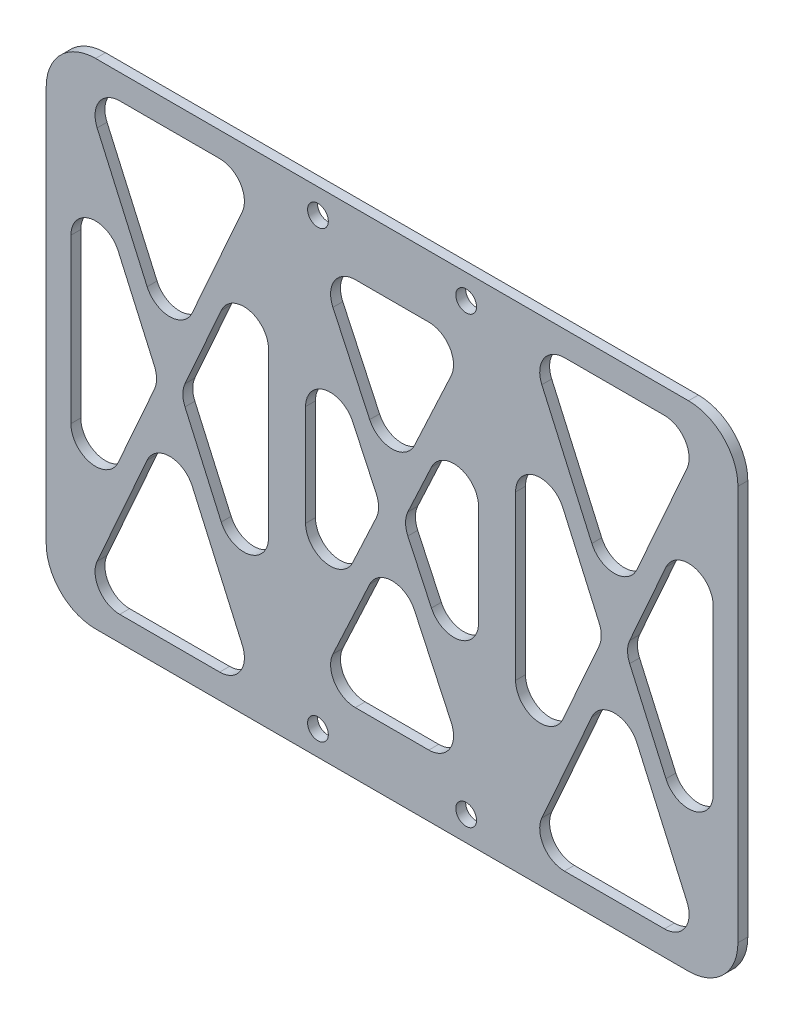
from build123d import *

# Parameters (mm, degrees)
SKETCH_1_W          = 140
SKETCH_1_H          = 100
EXTRUDE_1_DEPTH     = 2
SKETCH_3_R          = 2.1
CUT_EXTRUDE_2_DEPTH = 10
CUT_EXTRUDE_3_DEPTH = 10
FILLET_1_R          = 5
FILLET_2_R          = 10


with BuildPart() as part:
    # 草图1 → 凸台-拉伸1 (new body)
    with BuildSketch(Plane.XY):
        Rectangle(SKETCH_1_W, SKETCH_1_H)
    extrude(amount=EXTRUDE_1_DEPTH)

    # 草图3 → 切除-拉伸2 (cut)
    with BuildSketch(Plane(origin=(0, 0, 0), x_dir=(-1, 0, 0), z_dir=(0, 0, -1))):
        with Locations((-15, -45)):
            Circle(SKETCH_3_R)
        with Locations((15, -45)):
            Circle(SKETCH_3_R)
        with Locations((15, 45)):
            Circle(SKETCH_3_R)
        with Locations((-15, 45)):
            Circle(SKETCH_3_R)
    extrude(amount=-CUT_EXTRUDE_2_DEPTH, mode=Mode.SUBTRACT)

    # 草图4 → 切除-拉伸3 (cut)
    with BuildSketch(Plane(origin=(0, 0, 0), x_dir=(-1, 0, 0), z_dir=(0, 0, -1))):
        Polygon((-17.5, 32.770587041), (-2.207059381, 0), (-17.5, -32.770587041), align=None)
        Polygon((-15.292940619, -37.5), (15.292940619, -37.5), (0, -4.729412959), align=None)
        Polygon((-15.292940619, 37.5), (15.292940619, 37.5), (0, 4.729412959), align=None)
        Polygon((17.5, -32.770587041), (17.5, 32.770587041), (2.207059381, 0), align=None)
        Polygon((-62.811364933, -45), (-45, -4.924428901), (-27.188635067, -45), align=None)
        Polygon((-65, -40.075571099), (-65, 40.075571099), (-47.188635067, 0), align=None)
        Polygon((-62.811364933, 45), (-27.188635067, 45), (-45, 4.924428901), align=None)
        Polygon((-25, -40.075571099), (-25, 40.075571099), (-42.811364933, 0), align=None)
        Polygon((42.811364933, 0), (25, 40.075571099), (25, -40.075571099), align=None)
        Polygon((45, -4.924428901), (27.188635067, -45), (62.811364933, -45), align=None)
        Polygon((45, 4.924428901), (27.188635067, 45), (62.811364933, 45), align=None)
        Polygon((65, -40.075571099), (47.188635067, 0), (65, 40.075571099), align=None)
    extrude(amount=-CUT_EXTRUDE_3_DEPTH, mode=Mode.SUBTRACT)

    # 圆角1
    fillet_1_edges = [part.edges().sort_by_distance(p)[0] for p in [
        (-62.811364933, 45, 1),
        (-45, 4.924428901, 1),
        (-27.188635067, 45, 1),
        (-65, 40.075571099, 1),
        (-65, -40.075571099, 1),
        (-47.188635067, 0, 1),
        (-45, -4.924428901, 1),
        (-62.811364933, -45, 1),
        (-27.188635067, -45, 1),
        (-2.207059381, 0, 1),
        (-17.5, 32.770587041, 1),
        (-17.5, -32.770587041, 1),
        (0, 4.729412959, 1),
        (15.292940619, 37.5, 1),
        (-15.292940619, 37.5, 1),
        (15.292940619, -37.5, 1),
        (0, -4.729412959, 1),
        (-15.292940619, -37.5, 1),
        (45, 4.924428901, 1),
        (62.811364933, 45, 1),
        (27.188635067, 45, 1),
        (65, 40.075571099, 1),
        (47.188635067, 0, 1),
        (65, -40.075571099, 1),
        (17.5, -32.770587041, 1),
        (17.5, 32.770587041, 1),
        (2.207059381, 0, 1),
        (-42.811364933, 0, 1),
        (-25, -40.075571099, 1),
        (-25, 40.075571099, 1),
        (27.188635067, -45, 1),
        (62.811364933, -45, 1),
        (45, -4.924428901, 1),
        (42.811364933, 0, 1),
        (25, 40.075571099, 1),
        (25, -40.075571099, 1),
    ]]
    fillet(fillet_1_edges, radius=FILLET_1_R)

    # 圆角2
    fillet_2_edges = [part.edges().sort_by_distance(p)[0] for p in [
        (-70, 50, 1),
        (70, 50, 1),
        (70, -50, 1),
        (-70, -50, 1),
    ]]
    fillet(fillet_2_edges, radius=FILLET_2_R)


solid = part.part
